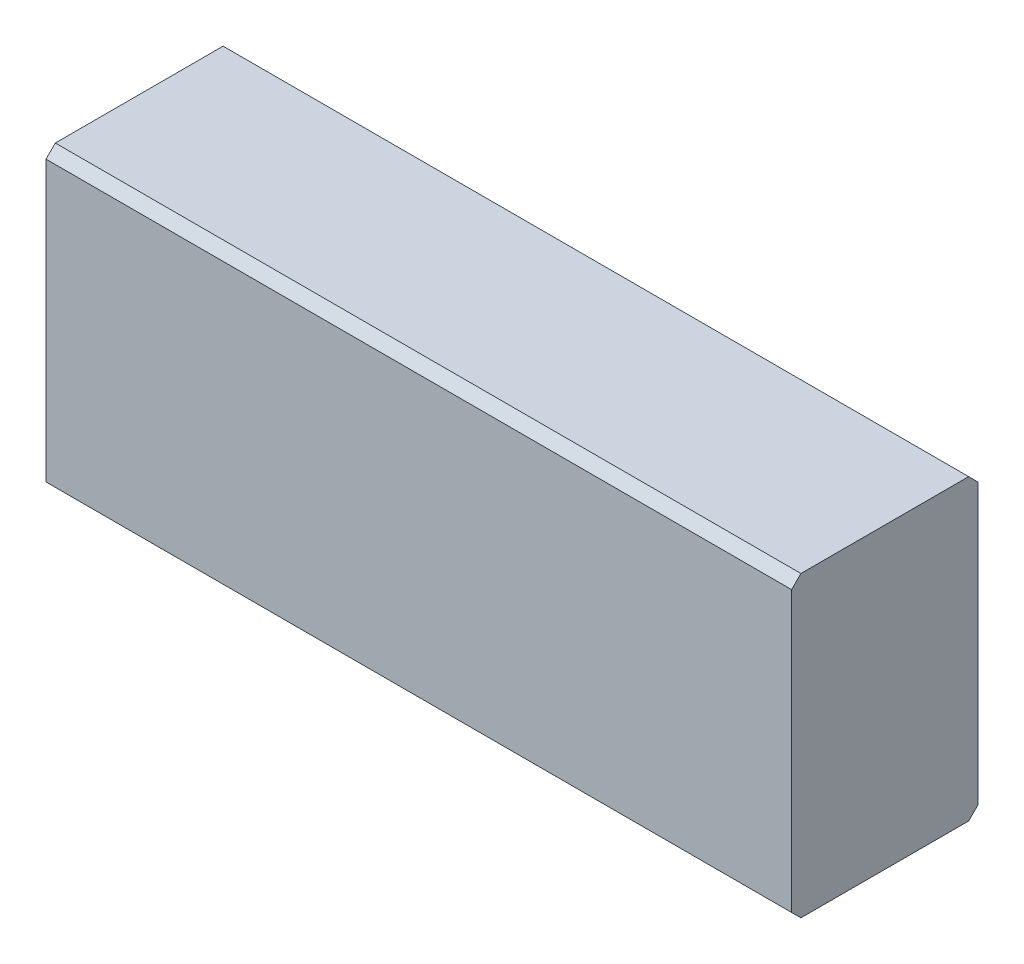
from build123d import *

# Parameters (mm, degrees)
EXTRUDE1_DEPTH = 5
SKETCH2_W      = 20
SKETCH2_H      = 8
EXTRUDE2_DEPTH = 5
CHAMFER1_SIZE  = 0.25


with BuildPart() as part:
    # Sketch1 → Extrude1 (new body)
    with BuildSketch(Plane.XY):
        with BuildLine():
            Line((0, 4), (-12, 4))
            ThreePointArc((-12, 4), (-16, 0), (-12, -4))
            Line((-12, -4), (0, -4))
            ThreePointArc((0, -4), (4, 0), (0, 4))
        make_face()
    extrude(amount=EXTRUDE1_DEPTH)

    # Sketch2 → Extrude2 (add)
    with BuildSketch(Plane.XY):
        with Locations((-6, 0)):
            Rectangle(SKETCH2_W, SKETCH2_H)
    extrude(amount=EXTRUDE2_DEPTH)

    # Chamfer1
    chamfer1_edges = [part.edges().sort_by_distance(p)[0] for p in [
        (-6, -4, 5),
        (-6, -4, 0),
        (-6, 4, 0),
        (-6, 4, 5),
    ]]
    chamfer(chamfer1_edges, length=CHAMFER1_SIZE)


solid = part.part
